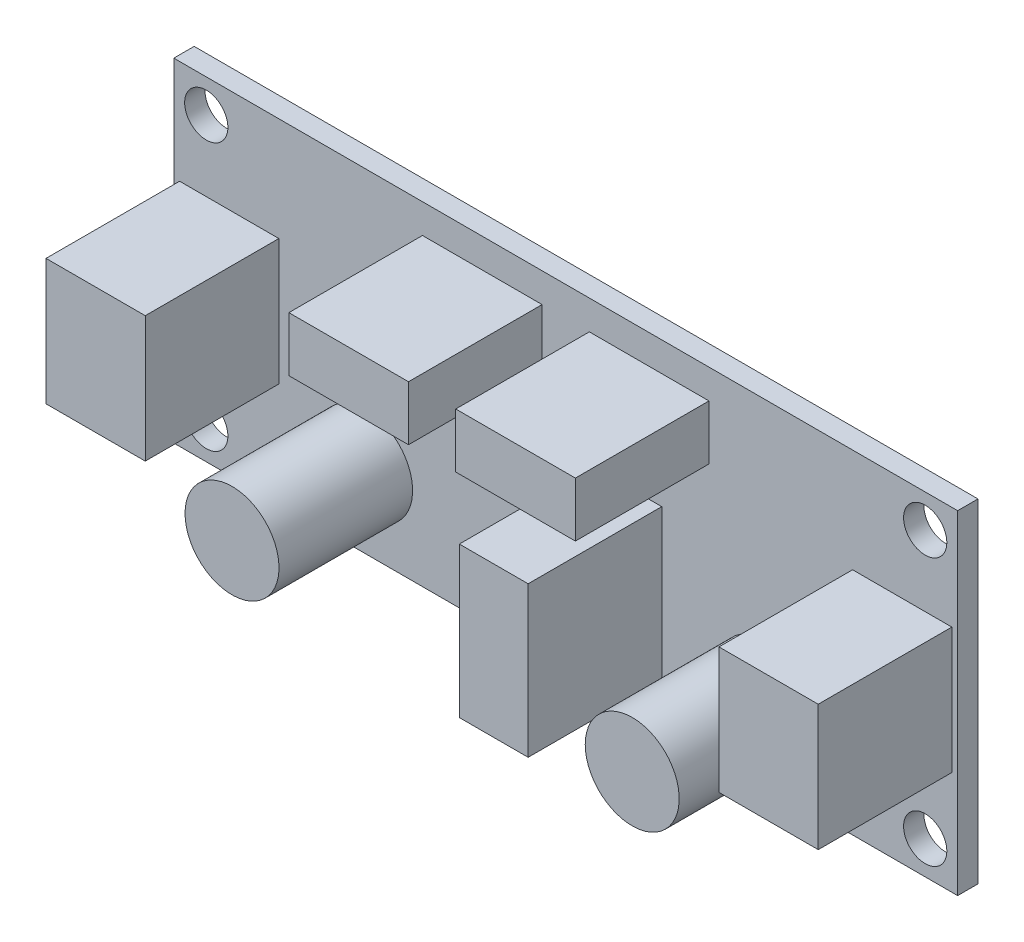
from build123d import *

# Parameters (mm, degrees)
ESQUISSE1_W        = 61.6
ESQUISSE1_H        = 26.2
BOSS_EXTRU_1_DEPTH = 1.6
D_GAGEMENT_M31_D   = 3.4
ESQUISSE5_R        = 3.691889044
ESQUISSE5_W        = 7.8
ESQUISSE5_H        = 9.9
ESQUISSE5_W_2      = 9.402735495
ESQUISSE5_H_2      = 4.28999807
ESQUISSE5_W_3      = 5.40657291
ESQUISSE5_H_3      = 11.812186467
BOSS_EXTRU_2_DEPTH = 10.5


with BuildPart() as part:
    # Esquisse1 → Boss.-Extru.1 (new body)
    with BuildSketch(Plane.XY):
        Rectangle(ESQUISSE1_W, ESQUISSE1_H)
    extrude(amount=BOSS_EXTRU_1_DEPTH)

    # Dégagement M31 (through all)
    with Locations(Plane.XY.offset(1.6)):
        with Locations((-28.25, 10.5), (28.25, 10.5), (28.25, -10.5), (-28.25, -10.5)):
            Hole(D_GAGEMENT_M31_D / 2)

    # Esquisse5 → Boss.-Extru.2 (add)
    with BuildSketch(Plane.XY.offset(1.6)):
        with Locations(Location((-15.725040559, -6.949067891, 0), (0, 0, 180))):
            Circle(ESQUISSE5_R)
        with Locations(Location((15.725040559, -6.949067891, 0), (0, 0, 180))):
            Circle(ESQUISSE5_R)
        with Locations((-26.443929164, 0)):
            Rectangle(ESQUISSE5_W, ESQUISSE5_H)
        with Locations((26.443929164, 0)):
            Rectangle(ESQUISSE5_W, ESQUISSE5_H)
        with Locations((6.557373451, 8.653596323)):
            Rectangle(ESQUISSE5_W_2, ESQUISSE5_H_2)
        with Locations((4.843443338, -4.157630791)):
            Rectangle(ESQUISSE5_W_3, ESQUISSE5_H_3)
        with Locations((-6.557373451, 8.653596323)):
            Rectangle(ESQUISSE5_W_2, ESQUISSE5_H_2)
    extrude(amount=BOSS_EXTRU_2_DEPTH)


solid = part.part
